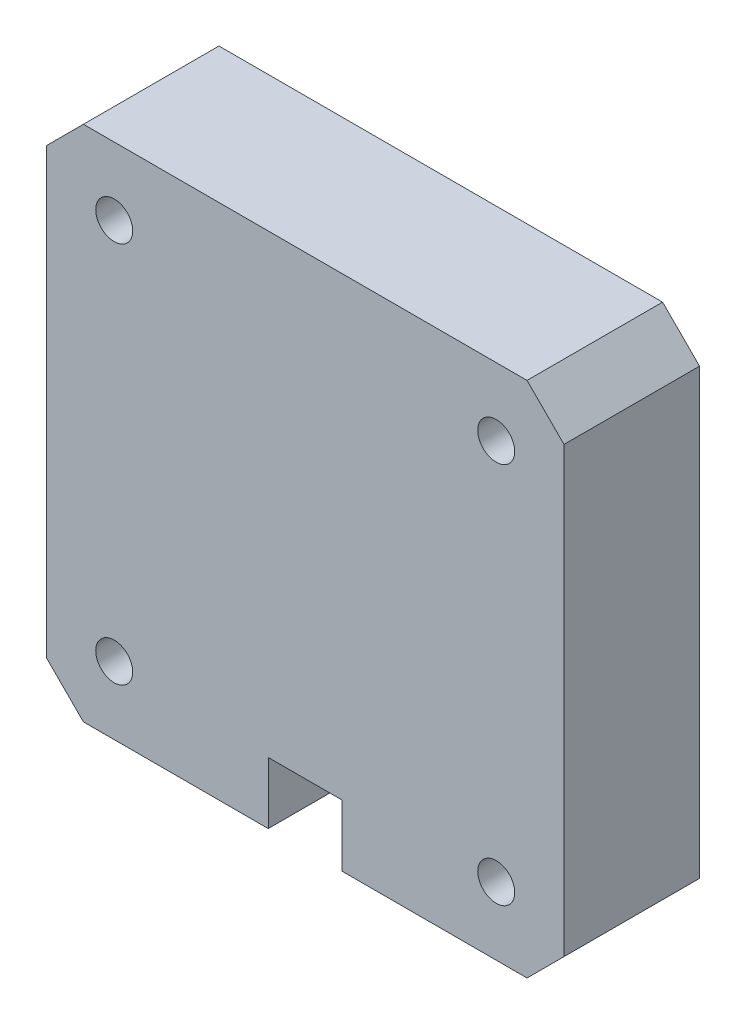
from build123d import *

# Parameters (mm, degrees)
SKETCH1_W           = 42
SKETCH1_H           = 42
BOSS_EXTRUDE1_DEPTH = 11
CHAMFER1_SIZE       = 3
CUT_EXTRUDE2_REACH  = 33.67
SKETCH3_R           = 1.5
SKETCH4_R           = 2.85
CUT_EXTRUDE3_DEPTH  = 3
SKETCH5_W           = 6
SKETCH5_H           = 7
CUT_EXTRUDE4_DEPTH  = 5


with BuildPart() as part:
    # Sketch1 → Boss-Extrude1 (new body)
    with BuildSketch(Plane.XY):
        Rectangle(SKETCH1_W, SKETCH1_H)
    extrude(amount=BOSS_EXTRUDE1_DEPTH)

    # Chamfer1
    chamfer1_edges = [part.edges().sort_by_distance(p)[0] for p in [
        (-21, 21, 5.5),
        (21, 21, 5.5),
        (21, -21, 5.5),
        (-21, -21, 5.5),
    ]]
    chamfer(chamfer1_edges, length=CHAMFER1_SIZE)

    # Sketch3 → Cut-Extrude2 (cut, up to next)
    with BuildSketch(Plane(origin=(0, 0, 0), x_dir=(-1, 0, 0), z_dir=(0, 0, -1)), mode=Mode.PRIVATE) as cut_extrude2_sk1:
        with Locations((-15.5, 15.5)):
            Circle(SKETCH3_R)
    cut_extrude2_tool1 = extrude(cut_extrude2_sk1.sketch, amount=-CUT_EXTRUDE2_REACH, mode=Mode.PRIVATE) & part.part
    # Sketch3 → Cut-Extrude2 (cut, up to next)
    with BuildSketch(Plane(origin=(0, 0, 0), x_dir=(-1, 0, 0), z_dir=(0, 0, -1)), mode=Mode.PRIVATE) as cut_extrude2_sk2:
        with Locations((15.5, 15.5)):
            Circle(SKETCH3_R)
    cut_extrude2_tool2 = extrude(cut_extrude2_sk2.sketch, amount=-CUT_EXTRUDE2_REACH, mode=Mode.PRIVATE) & part.part
    # Sketch3 → Cut-Extrude2 (cut, up to next)
    with BuildSketch(Plane(origin=(0, 0, 0), x_dir=(-1, 0, 0), z_dir=(0, 0, -1)), mode=Mode.PRIVATE) as cut_extrude2_sk3:
        with Locations((15.5, -15.5)):
            Circle(SKETCH3_R)
    cut_extrude2_tool3 = extrude(cut_extrude2_sk3.sketch, amount=-CUT_EXTRUDE2_REACH, mode=Mode.PRIVATE) & part.part
    # Sketch3 → Cut-Extrude2 (cut, up to next)
    with BuildSketch(Plane(origin=(0, 0, 0), x_dir=(-1, 0, 0), z_dir=(0, 0, -1)), mode=Mode.PRIVATE) as cut_extrude2_sk4:
        with Locations((-15.5, -15.5)):
            Circle(SKETCH3_R)
    cut_extrude2_tool4 = extrude(cut_extrude2_sk4.sketch, amount=-CUT_EXTRUDE2_REACH, mode=Mode.PRIVATE) & part.part
    add(cut_extrude2_tool1.solids().sort_by_distance((15.5, 15.5, 0))[0], mode=Mode.SUBTRACT)
    add(cut_extrude2_tool2.solids().sort_by_distance((-15.5, 15.5, 0))[0], mode=Mode.SUBTRACT)
    add(cut_extrude2_tool3.solids().sort_by_distance((-15.5, -15.5, 0))[0], mode=Mode.SUBTRACT)
    add(cut_extrude2_tool4.solids().sort_by_distance((15.5, -15.5, 0))[0], mode=Mode.SUBTRACT)

    # Sketch4 → Cut-Extrude3 (cut)
    with BuildSketch(Plane(origin=(0, 0, 0), x_dir=(-1, 0, 0), z_dir=(0, 0, -1))):
        with Locations((-15.5, 15.5)):
            Circle(SKETCH4_R)
        with Locations((15.5, 15.5)):
            Circle(SKETCH4_R)
        with Locations((15.5, -15.5)):
            Circle(SKETCH4_R)
        with Locations((-15.5, -15.5)):
            Circle(SKETCH4_R)
    extrude(amount=-CUT_EXTRUDE3_DEPTH, mode=Mode.SUBTRACT)

    # Sketch5 → Cut-Extrude4 (cut)
    with BuildSketch(Plane.XZ.offset(21)):
        with Locations((0, 7.5)):
            Rectangle(SKETCH5_W, SKETCH5_H)
    extrude(amount=-CUT_EXTRUDE4_DEPTH, mode=Mode.SUBTRACT)


solid = part.part
